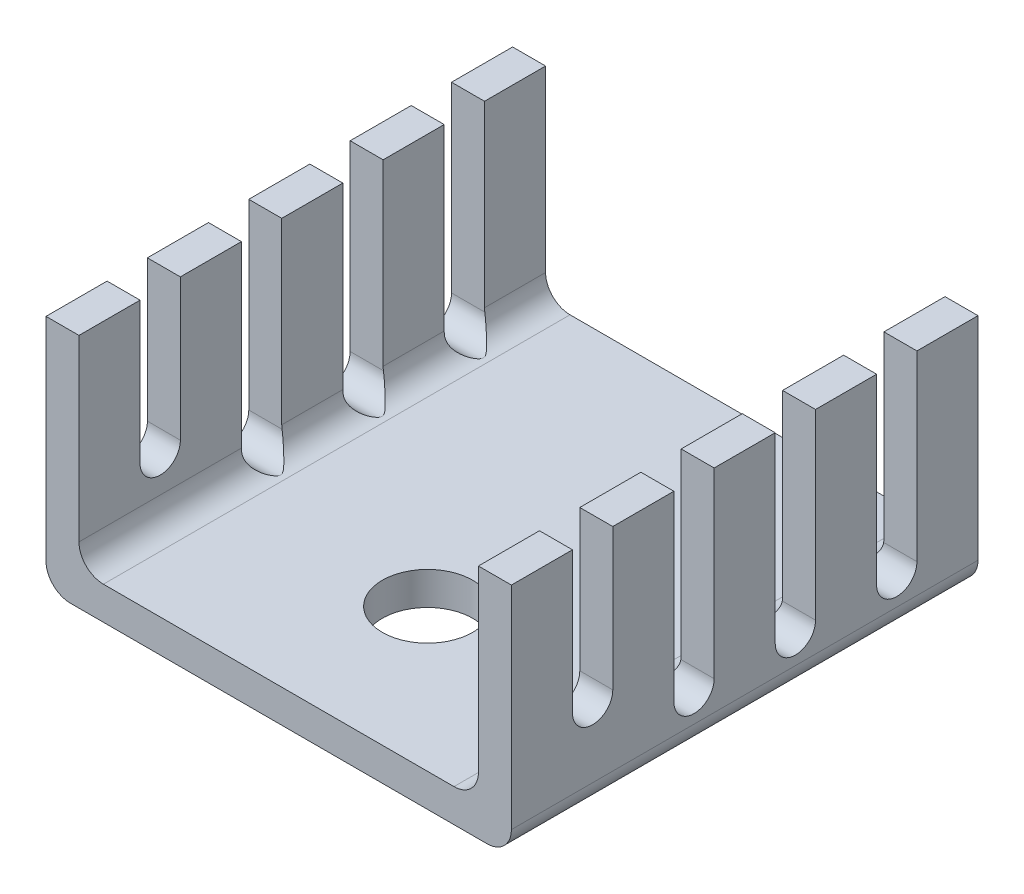
from build123d import *

# Parameters (mm, degrees)
BOSS_EXTRUDE3_DEPTH = 19.1
CUT_EXTRUDE2_REACH  = 24.908
SKETCH3_R           = 1.85
CUT_EXTRUDE3_DEPTH  = 29.65696076


with BuildPart() as part:
    # Sketch1 → Boss-Extrude3 (new body)
    with BuildSketch(Plane.XY):
        with BuildLine():
            Line((-8.525, 0), (8.525, 0))
            ThreePointArc((8.525, 0), (9.232106781, 0.292893219), (9.525, 1))
            Line((9.525, 1), (9.525, 9.67))
            Line((9.525, 9.67), (8.175, 9.67))
            Line((8.175, 9.67), (8.175, 2.35))
            ThreePointArc((8.175, 2.35), (7.882106781, 1.642893219), (7.175, 1.35))
            Line((7.175, 1.35), (-7.175, 1.35))
            ThreePointArc((-7.175, 1.35), (-7.882106781, 1.642893219), (-8.175, 2.35))
            Line((-8.175, 2.35), (-8.175, 9.67))
            Line((-8.175, 9.67), (-9.525, 9.67))
            Line((-9.525, 9.67), (-9.525, 1))
            ThreePointArc((-9.525, 1), (-9.232106781, 0.292893219), (-8.525, 0))
        make_face()
    extrude(amount=-BOSS_EXTRUDE3_DEPTH)

    # Sketch3 → Cut-Extrude2 (cut, up to next)
    with BuildSketch(Plane(origin=(0, 1.35, 0), x_dir=(1, 0, 0), z_dir=(0, 1, 0)), mode=Mode.PRIVATE) as cut_extrude2_sk1:
        with Locations(Location((0.241401012, 5.85, 0), (0, 0, 270))):
            Circle(SKETCH3_R)
    cut_extrude2_tool1 = extrude(cut_extrude2_sk1.sketch, amount=-CUT_EXTRUDE2_REACH, mode=Mode.PRIVATE) & part.part
    add(cut_extrude2_tool1.solids().sort_by_distance((0.241401, 1.35, -5.85))[0], mode=Mode.SUBTRACT)

    # Sketch4 → Cut-Extrude3 (cut, through all)
    with BuildSketch(Plane(origin=(9.525, 0, 0), x_dir=(0, 0, -1), z_dir=(1, 0, 0))):
        with BuildLine():
            Line((2.5, 9.67), (2.5, 3.88))
            ThreePointArc((2.5, 3.88), (3.325, 3.055), (4.15, 3.88))
            Line((4.15, 3.88), (4.15, 9.67))
            Line((4.15, 9.67), (2.5, 9.67))
        make_face()
        with BuildLine():
            Line((6.65, 9.67), (6.65, 2.2))
            ThreePointArc((6.65, 2.2), (7.475, 1.375), (8.3, 2.2))
            Line((8.3, 2.2), (8.3, 9.67))
            Line((8.3, 9.67), (6.65, 9.67))
        make_face()
        with BuildLine():
            Line((10.8, 9.67), (10.8, 2.2))
            ThreePointArc((10.8, 2.2), (11.625, 1.375), (12.45, 2.2))
            Line((12.45, 2.2), (12.45, 9.67))
            Line((12.45, 9.67), (10.8, 9.67))
        make_face()
        with BuildLine():
            Line((14.95, 9.67), (14.95, 2.2))
            ThreePointArc((14.95, 2.2), (15.775, 1.375), (16.6, 2.2))
            Line((16.6, 2.2), (16.6, 9.67))
            Line((16.6, 9.67), (14.95, 9.67))
        make_face()
    extrude(amount=-CUT_EXTRUDE3_DEPTH, mode=Mode.SUBTRACT)


solid = part.part
